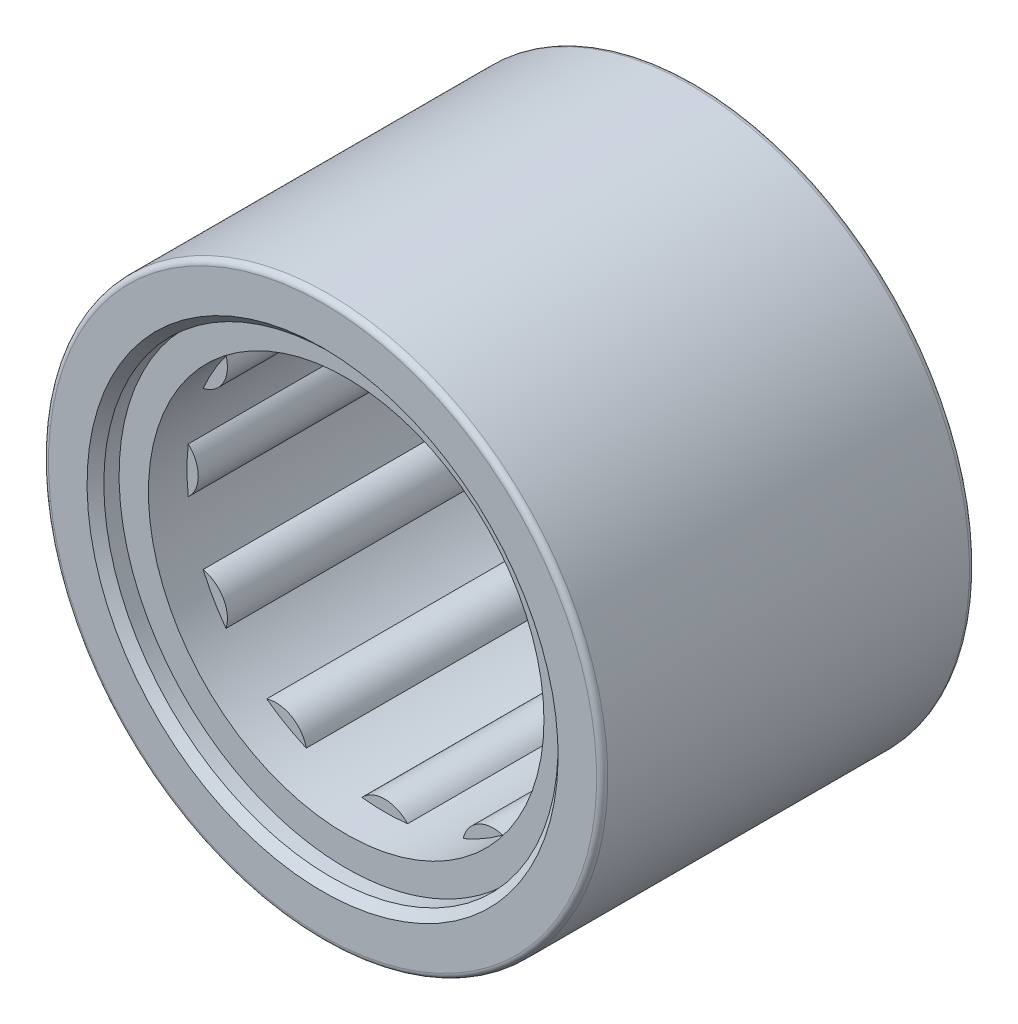
from build123d import *
from build123d.topology import SkipClean

# Parameters (mm, degrees)
SKETCH2_W           = 8.466666666
SKETCH2_H           = 0.79375
SKETCH3_W           = 10.583333334
SKETCH3_H           = 0.264583334
CIRPATTERN1_COUNT   = 12
CIRPATTERN1_ANGLE   = 330
FILLET1_R           = 0.1905
SKETCH7_R           = 8.466666667
SKETCH7_R_2         = 6.736291667
BOSS_EXTRUDE1_DEPTH = 10.583333333
SKETCH8_R           = 7.736416667
CUT_EXTRUDE1_DEPTH  = 19.513272386
CHAMFER1_SIZE       = 0.28575
BOSS_EXTRUDE3_START = 0.254
SKETCH10_R          = 7.736416667
SKETCH10_R_2        = 6.736291667
BOSS_EXTRUDE3_DEPTH = 0.254
CUT_EXTRUDE2_DEPTH  = 8.466666667
CIRPATTERN2_COUNT   = 12
BOSS_EXTRUDE4_START = -1.058333
SKETCH12_R          = 7.736416667
SKETCH12_R_2        = 6.736291667
BOSS_EXTRUDE4_DEPTH = 1.058333


with BuildPart() as part:
    # Sketch1 → Revolve1 (revolve)
    with BuildSketch(Plane(origin=(0, 0, 0), x_dir=(0, 0, -1), z_dir=(1, 0, 0)), mode=Mode.PRIVATE) as revolve1_sk:
        Polygon((-6.35, 9.525), (6.35, 9.525), (6.35, 6.879166667), (5.291666667, 6.879166667), (5.291666667, 8.466666667), (-5.291666667, 8.466666667), (-5.291666667, 6.879166667), (-6.35, 6.879166667), align=None)
    revolve(revolve1_sk.sketch.rotate(Axis((0, 0, 6.35), (0, 0, -1)), 180), axis=Axis((0, 0, 6.35), (0, 0, -1)))

    # Fillet1
    fillet1_edges = [part.edges().sort_by_distance(p)[0] for p in [
        (0, 9.525, 6.35),
        (0, 9.525, -6.35),
    ]]
    fillet(fillet1_edges, radius=FILLET1_R)

    # Sketch8 → Cut-Extrude1 (cut, through all)
    with BuildSketch(Plane.XY.offset(6.35)):
        Circle(SKETCH8_R)
    extrude(amount=-CUT_EXTRUDE1_DEPTH, mode=Mode.SUBTRACT)

    # Chamfer1
    chamfer1_edges = [part.edges().sort_by_distance(p)[0] for p in [
        (-7.736416667, 0, 6.35),
    ]]
    chamfer(chamfer1_edges, length=CHAMFER1_SIZE)

    # Sketch12 → Boss-Extrude4 (add)
    with BuildSketch(Plane(origin=(0, 0, -6.35), x_dir=(-1, 0, 0), z_dir=(0, 0, -1)).offset(BOSS_EXTRUDE4_START)):
        with Locations(Location((0, 0, 0), (0, 0, 90))):
            Circle(SKETCH12_R)
        with Locations(Location((0, 0, 0), (0, 0, 180))):
            Circle(SKETCH12_R_2, mode=Mode.SUBTRACT)
    extrude(amount=BOSS_EXTRUDE4_DEPTH)


with BuildPart() as body_2:
    # Sketch2 → Revolve2 (revolve)
    with BuildSketch(Plane(origin=(0, 0, 0), x_dir=(0, 0, -1), z_dir=(1, 0, 0)), mode=Mode.PRIVATE) as revolve2_sk:
        with Locations((0, 8.069791667)):
            Rectangle(SKETCH2_W, SKETCH2_H)
    revolve(revolve2_sk.sketch.rotate(Axis((0, 7.408333333, 4.233333333), (0, 0, -1)), 90), axis=Axis((0, 7.408333333, 4.233333333), (0, 0, -1)))


with BuildPart() as body_3:
    # Sketch3 → Revolve3 (revolve)
    with BuildSketch(Plane(origin=(0, 0, 0), x_dir=(0, 0, -1), z_dir=(1, 0, 0)), mode=Mode.PRIVATE) as revolve3_sk:
        with Locations((0, 7.540625)):
            Rectangle(SKETCH3_W, SKETCH3_H)
    revolve(revolve3_sk.sketch.rotate(Axis((0, 7.408333333, 5.291666667), (0, 0, -1)), 180), axis=Axis((0, 7.408333333, 5.291666667), (0, 0, -1)))


with BuildPart() as cirpattern1_1:
    # CirPattern1: pattern copy
    add(body_2.part.rotate(Axis((0, 0, -6.35), (0, 0, 1)), 1 * CIRPATTERN1_ANGLE / (CIRPATTERN1_COUNT - 1)))


with BuildPart() as cirpattern1_2:
    # CirPattern1: pattern copy
    add(body_2.part.rotate(Axis((0, 0, -6.35), (0, 0, 1)), 2 * CIRPATTERN1_ANGLE / (CIRPATTERN1_COUNT - 1)))


with BuildPart() as cirpattern1_3:
    # CirPattern1: pattern copy
    add(body_2.part.rotate(Axis((0, 0, -6.35), (0, 0, 1)), 3 * CIRPATTERN1_ANGLE / (CIRPATTERN1_COUNT - 1)))


with BuildPart() as cirpattern1_4:
    # CirPattern1: pattern copy
    add(body_2.part.rotate(Axis((0, 0, -6.35), (0, 0, 1)), 4 * CIRPATTERN1_ANGLE / (CIRPATTERN1_COUNT - 1)))


with BuildPart() as cirpattern1_5:
    # CirPattern1: pattern copy
    add(body_2.part.rotate(Axis((0, 0, -6.35), (0, 0, 1)), 5 * CIRPATTERN1_ANGLE / (CIRPATTERN1_COUNT - 1)))


with BuildPart() as cirpattern1_6:
    # CirPattern1: pattern copy
    add(body_2.part.rotate(Axis((0, 0, -6.35), (0, 0, 1)), 6 * CIRPATTERN1_ANGLE / (CIRPATTERN1_COUNT - 1)))


with BuildPart() as cirpattern1_7:
    # CirPattern1: pattern copy
    add(body_2.part.rotate(Axis((0, 0, -6.35), (0, 0, 1)), 7 * CIRPATTERN1_ANGLE / (CIRPATTERN1_COUNT - 1)))


with BuildPart() as cirpattern1_8:
    # CirPattern1: pattern copy
    add(body_2.part.rotate(Axis((0, 0, -6.35), (0, 0, 1)), 8 * CIRPATTERN1_ANGLE / (CIRPATTERN1_COUNT - 1)))


with BuildPart() as cirpattern1_9:
    # CirPattern1: pattern copy
    add(body_2.part.rotate(Axis((0, 0, -6.35), (0, 0, 1)), 9 * CIRPATTERN1_ANGLE / (CIRPATTERN1_COUNT - 1)))


with BuildPart() as cirpattern1_10:
    # CirPattern1: pattern copy
    add(body_2.part.rotate(Axis((0, 0, -6.35), (0, 0, 1)), 10 * CIRPATTERN1_ANGLE / (CIRPATTERN1_COUNT - 1)))


with BuildPart() as cirpattern1_11:
    # CirPattern1: pattern copy
    add(body_2.part.rotate(Axis((0, 0, -6.35), (0, 0, 1)), 11 * CIRPATTERN1_ANGLE / (CIRPATTERN1_COUNT - 1)))


with BuildPart() as cirpattern1_12:
    # CirPattern1: pattern copy
    add(body_3.part.rotate(Axis((0, 0, -6.35), (0, 0, 1)), 1 * CIRPATTERN1_ANGLE / (CIRPATTERN1_COUNT - 1)))


with BuildPart() as cirpattern1_13:
    # CirPattern1: pattern copy
    add(body_3.part.rotate(Axis((0, 0, -6.35), (0, 0, 1)), 2 * CIRPATTERN1_ANGLE / (CIRPATTERN1_COUNT - 1)))


with BuildPart() as cirpattern1_14:
    # CirPattern1: pattern copy
    add(body_3.part.rotate(Axis((0, 0, -6.35), (0, 0, 1)), 3 * CIRPATTERN1_ANGLE / (CIRPATTERN1_COUNT - 1)))


with BuildPart() as cirpattern1_15:
    # CirPattern1: pattern copy
    add(body_3.part.rotate(Axis((0, 0, -6.35), (0, 0, 1)), 4 * CIRPATTERN1_ANGLE / (CIRPATTERN1_COUNT - 1)))


with BuildPart() as cirpattern1_16:
    # CirPattern1: pattern copy
    add(body_3.part.rotate(Axis((0, 0, -6.35), (0, 0, 1)), 5 * CIRPATTERN1_ANGLE / (CIRPATTERN1_COUNT - 1)))


with BuildPart() as cirpattern1_17:
    # CirPattern1: pattern copy
    add(body_3.part.rotate(Axis((0, 0, -6.35), (0, 0, 1)), 6 * CIRPATTERN1_ANGLE / (CIRPATTERN1_COUNT - 1)))


with BuildPart() as cirpattern1_18:
    # CirPattern1: pattern copy
    add(body_3.part.rotate(Axis((0, 0, -6.35), (0, 0, 1)), 7 * CIRPATTERN1_ANGLE / (CIRPATTERN1_COUNT - 1)))


with BuildPart() as cirpattern1_19:
    # CirPattern1: pattern copy
    add(body_3.part.rotate(Axis((0, 0, -6.35), (0, 0, 1)), 8 * CIRPATTERN1_ANGLE / (CIRPATTERN1_COUNT - 1)))


with BuildPart() as cirpattern1_20:
    # CirPattern1: pattern copy
    add(body_3.part.rotate(Axis((0, 0, -6.35), (0, 0, 1)), 9 * CIRPATTERN1_ANGLE / (CIRPATTERN1_COUNT - 1)))


with BuildPart() as cirpattern1_21:
    # CirPattern1: pattern copy
    add(body_3.part.rotate(Axis((0, 0, -6.35), (0, 0, 1)), 10 * CIRPATTERN1_ANGLE / (CIRPATTERN1_COUNT - 1)))


with BuildPart() as cirpattern1_22:
    # CirPattern1: pattern copy
    add(body_3.part.rotate(Axis((0, 0, -6.35), (0, 0, 1)), 11 * CIRPATTERN1_ANGLE / (CIRPATTERN1_COUNT - 1)))


with BuildPart() as body_26:
    # Sketch7 → Boss-Extrude1 (new body)
    with BuildSketch(Plane(origin=(0, 0, 5.291666667), x_dir=(-1, 0, 0), z_dir=(0, 0, -1))):
        with Locations(Location((0, 0, 0), (0, 0, 90))):
            Circle(SKETCH7_R)
        with Locations(Location((0, 0, 0), (0, 0, 90))):
            Circle(SKETCH7_R_2, mode=Mode.SUBTRACT)
    extrude(amount=BOSS_EXTRUDE1_DEPTH)

    # Sketch10 → Boss-Extrude3 (add)
    with SkipClean():  # the faces are left unmerged after this step: merging them gives an invalid solid
        with BuildSketch(Plane.XY.offset(5.291666667).offset(BOSS_EXTRUDE3_START)):
            with Locations(Location((0, 0, 0), (0, 0, 90))):
                Circle(SKETCH10_R)
            Circle(SKETCH10_R_2, mode=Mode.SUBTRACT)
        extrude(amount=-BOSS_EXTRUDE3_DEPTH)

    # Sketch11 → Cut-Extrude2 (cut)
    with SkipClean():  # the faces are left unmerged after this step: merging them gives an invalid solid
        with BuildSketch(Plane.XY.offset(4.233333333)):
            with BuildLine():
                Line((-1.058333333, 7.408333333), (-1.058333333, 9.525))
                Line((-1.058333333, 9.525), (1.058333333, 9.525))
                Line((1.058333333, 9.525), (1.058333333, 7.408333333))
                ThreePointArc((1.058333333, 7.408333333), (0, 6.35), (-1.058333333, 7.408333333))
            make_face()
        cut_extrude2 = extrude(amount=-CUT_EXTRUDE2_DEPTH, mode=Mode.SUBTRACT)

    # CirPattern2: Cut-Extrude2 ×12 about axis
    with SkipClean():  # the faces are left unmerged after this step: merging them gives an invalid solid
        cirpattern2_axis = Axis((0, 0, 0), (0, 0, 1))
        for i in range(1, CIRPATTERN2_COUNT):
            add(cut_extrude2.rotate(cirpattern2_axis, i * 360 / CIRPATTERN2_COUNT), mode=Mode.SUBTRACT)


solid = Compound([part.part, body_2.part, body_3.part, cirpattern1_1.part, cirpattern1_2.part, cirpattern1_3.part, cirpattern1_4.part, cirpattern1_5.part, cirpattern1_6.part, cirpattern1_7.part, cirpattern1_8.part, cirpattern1_9.part, cirpattern1_10.part, cirpattern1_11.part, cirpattern1_12.part, cirpattern1_13.part, cirpattern1_14.part, cirpattern1_15.part, cirpattern1_16.part, cirpattern1_17.part, cirpattern1_18.part, cirpattern1_19.part, cirpattern1_20.part, cirpattern1_21.part, cirpattern1_22.part, body_26.part])
